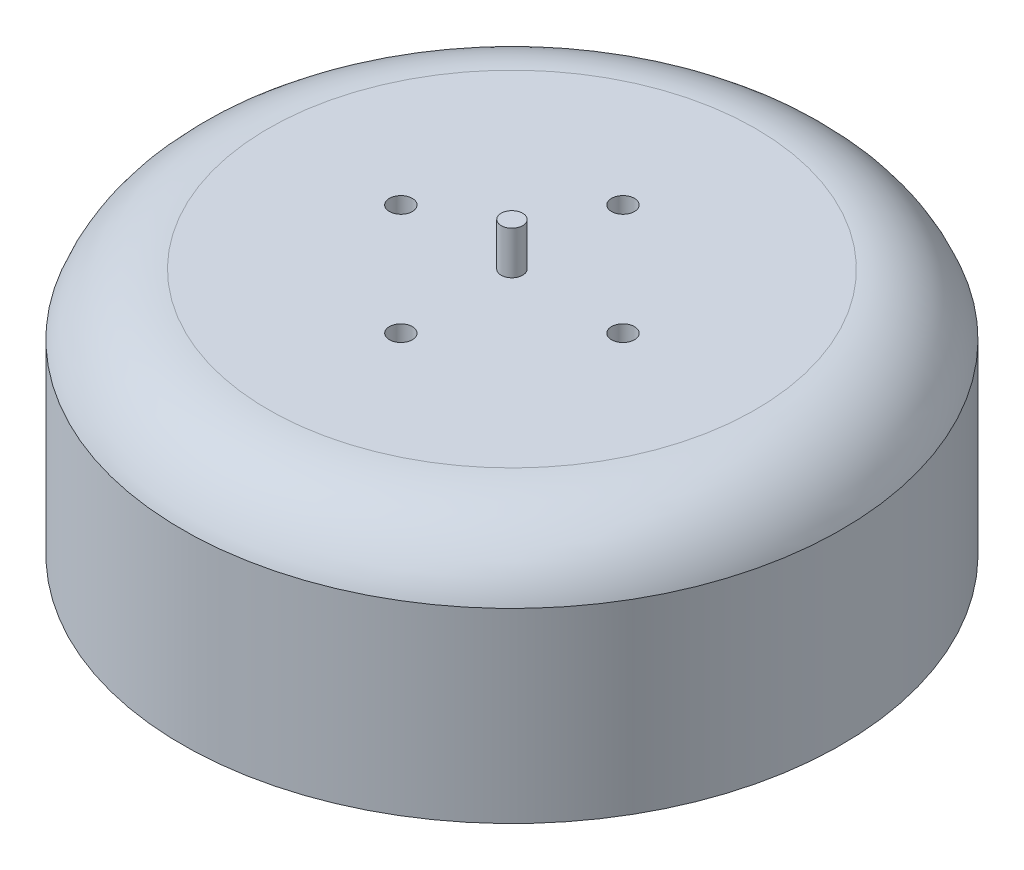
from build123d import *

# Parameters (mm, degrees)
CROQUIS2_R                          = 7
SALIENTE_EXTRUIR1_DEPTH             = 3
CROQUIS3_R                          = 1.5
SALIENTE_EXTRUIR2_DEPTH             = 6
DI_METRO_DE_TALADRO_3_2_3_2_1_D     = 3.2
DI_METRO_DE_TALADRO_3_2_3_2_1_DEPTH = 10
DI_METRO_DE_TALADRO_4_2_4_2_1_D     = 4.2
DI_METRO_DE_TALADRO_4_2_4_2_1_DEPTH = 12
CHAFL_N1_SIZE                       = 18
CHAFL_N1_SIZE2                      = 4


with BuildPart() as part:
    # Croquis1 → Revolución1 (revolve)
    with BuildSketch(Plane.XY, mode=Mode.PRIVATE) as revoluci_n1_sk:
        with BuildLine():
            Line((34, 38.5), (0, 38.5))
            Line((0, 38.5), (0, 0))
            Line((0, 0), (46, 0))
            Line((46, 0), (46, 30))
            ThreePointArc((46, 30), (41.352720585, 36.159723179), (34, 38.5))
        make_face()
    revolve(revoluci_n1_sk.sketch.rotate(Axis((0, 38.5, 0), (0, -1, 0)), 270), axis=Axis((0, 38.5, 0), (0, -1, 0)))

    # Croquis2 → Saliente-Extruir1 (add)
    with BuildSketch(Plane.XZ):
        with Locations(Location((0, 0, 0), (0, 0, 270))):
            Circle(CROQUIS2_R)
    extrude(amount=SALIENTE_EXTRUIR1_DEPTH)

    # Croquis3 → Saliente-Extruir2 (add)
    with BuildSketch(Plane(origin=(0, 38.5, 0), x_dir=(-1, 0, 0), z_dir=(0, 1, 0))):
        with Locations(Location((0, 0, 0), (0, 0, 90))):
            Circle(CROQUIS3_R)
    extrude(amount=SALIENTE_EXTRUIR2_DEPTH)

    # Diámetro de taladro Ø3.2 (3.2)1
    with Locations(Plane(origin=(0, 38.5, 0), x_dir=(1, 0, 0), z_dir=(0, 1, 0))):
        with Locations((0, 15.5), (-15.5, 0), (15.5, 0), (0, -15.5)):
            Hole(DI_METRO_DE_TALADRO_3_2_3_2_1_D / 2, depth=DI_METRO_DE_TALADRO_3_2_3_2_1_DEPTH)

    # Diámetro de taladro Ø4.2 (4.2)1
    with Locations(Plane(origin=(0, 0, 0), x_dir=(-1, 0, 0), z_dir=(0, -1, 0))):
        with Locations((0, -20), (20, 0), (-20, 0), (0, 20)):
            Hole(DI_METRO_DE_TALADRO_4_2_4_2_1_D / 2, depth=DI_METRO_DE_TALADRO_4_2_4_2_1_DEPTH)

    # Chaflán1
    chafl_n1_edges = [part.edges().sort_by_distance(p)[0] for p in [
        (0, 0, 46),
    ]]
    chafl_n1_side = [part.faces().sort_by_distance(p)[0] for p in [
        (0, 0, 44.698923523),
    ]]
    chamfer(chafl_n1_edges, length=CHAFL_N1_SIZE, length2=CHAFL_N1_SIZE2, reference=chafl_n1_side[0])


solid = part.part
